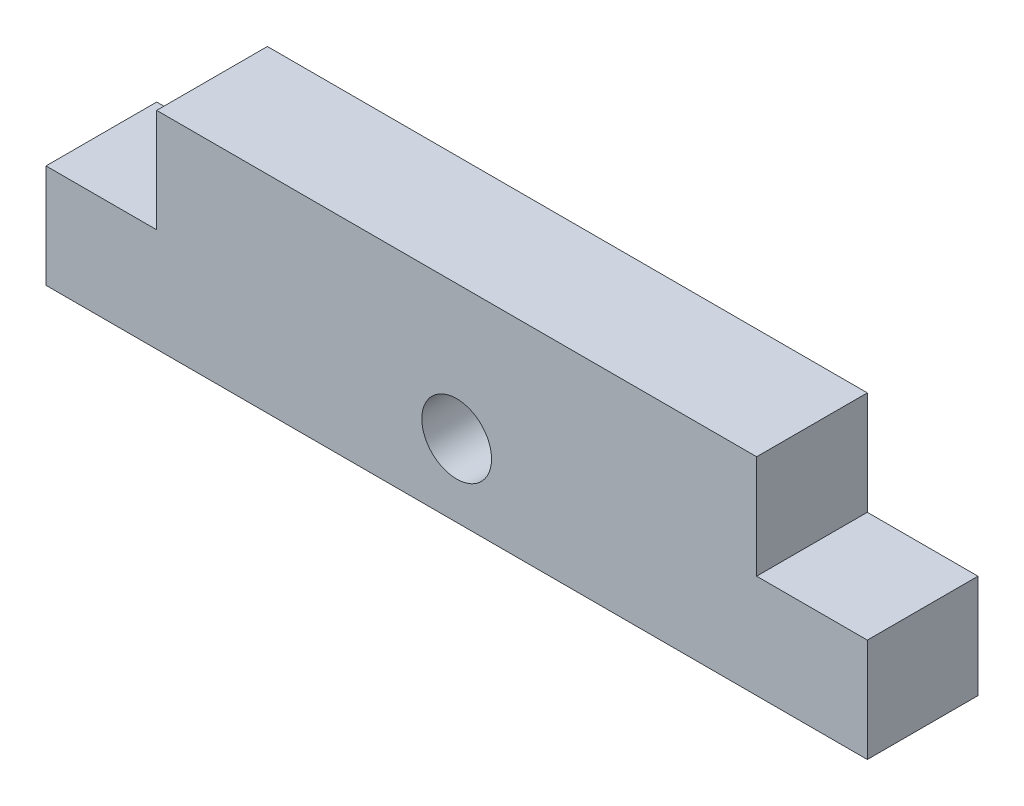
from build123d import *

# Parameters (mm, degrees)
MODEL_R             = 1.685
BOSS_EXTRUDE1_DEPTH = 5.35


with BuildPart() as part:
    # Model → Boss-Extrude1 (new body)
    with BuildSketch(Plane.XY):
        Polygon((-19.85, 0), (19.85, 0), (19.85, 5), (14.5, 5), (14.5, 10), (-14.5, 10), (-14.5, 5), (-19.85, 5), align=None)
        with Locations((0, 3.5)):
            Circle(MODEL_R, mode=Mode.SUBTRACT)
    extrude(amount=BOSS_EXTRUDE1_DEPTH)


solid = part.part
